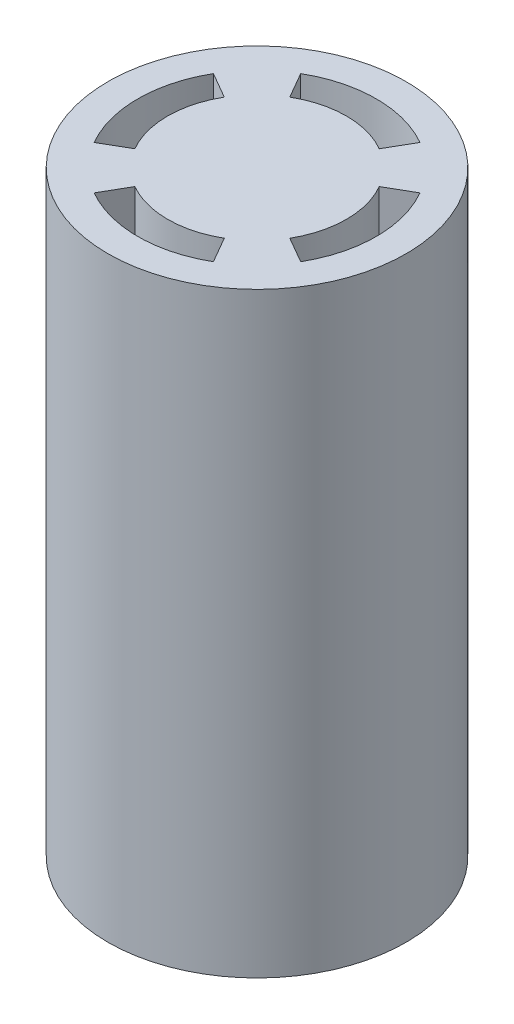
from build123d import *

# Parameters (mm, degrees)
SKETCH1_R           = 5
BOSS_EXTRUDE1_DEPTH = 20
SKETCH2_R           = 0.75
CUT_EXTRUDE1_DEPTH  = 15


with BuildPart() as part:
    # Sketch1 → Boss-Extrude1 (new body)
    with BuildSketch(Plane(origin=(0, 0, 0), x_dir=(1, 0, 0), z_dir=(0, 1, 0))):
        with Locations(Location((0, 0, 0), (0, 0, 270))):
            Circle(SKETCH1_R)
        with BuildLine():
            Line((-2, 3.464101615), (-1.5, 2.598076211))
            ThreePointArc((-1.5, 2.598076211), (0, 3), (1.5, 2.598076211))
            Line((1.5, 2.598076211), (2, 3.464101615))
            ThreePointArc((2, 3.464101615), (0, 4), (-2, 3.464101615))
        make_face(mode=Mode.SUBTRACT)
        with BuildLine():
            Line((2.598076211, -1.5), (3.464101615, -2))
            ThreePointArc((3.464101615, -2), (4, 0), (3.464101615, 2))
            Line((3.464101615, 2), (2.598076211, 1.5))
            ThreePointArc((2.598076211, 1.5), (3, 0), (2.598076211, -1.5))
        make_face(mode=Mode.SUBTRACT)
        with BuildLine():
            Line((-1.5, -2.598076211), (-2, -3.464101615))
            ThreePointArc((-2, -3.464101615), (0, -4), (2, -3.464101615))
            Line((2, -3.464101615), (1.5, -2.598076211))
            ThreePointArc((1.5, -2.598076211), (0, -3), (-1.5, -2.598076211))
        make_face(mode=Mode.SUBTRACT)
        with BuildLine():
            Line((-2.598076211, 1.5), (-3.464101615, 2))
            ThreePointArc((-3.464101615, 2), (-4, 0), (-3.464101615, -2))
            Line((-3.464101615, -2), (-2.598076211, -1.5))
            ThreePointArc((-2.598076211, -1.5), (-3, 0), (-2.598076211, 1.5))
        make_face(mode=Mode.SUBTRACT)
    extrude(amount=BOSS_EXTRUDE1_DEPTH)

    # Sketch2 → Cut-Extrude1 (cut)
    with BuildSketch(Plane.XZ):
        with Locations(Location((0, 0, 0), (0, 0, 270))):
            Circle(SKETCH2_R)
    extrude(amount=-CUT_EXTRUDE1_DEPTH, mode=Mode.SUBTRACT)


solid = part.part
